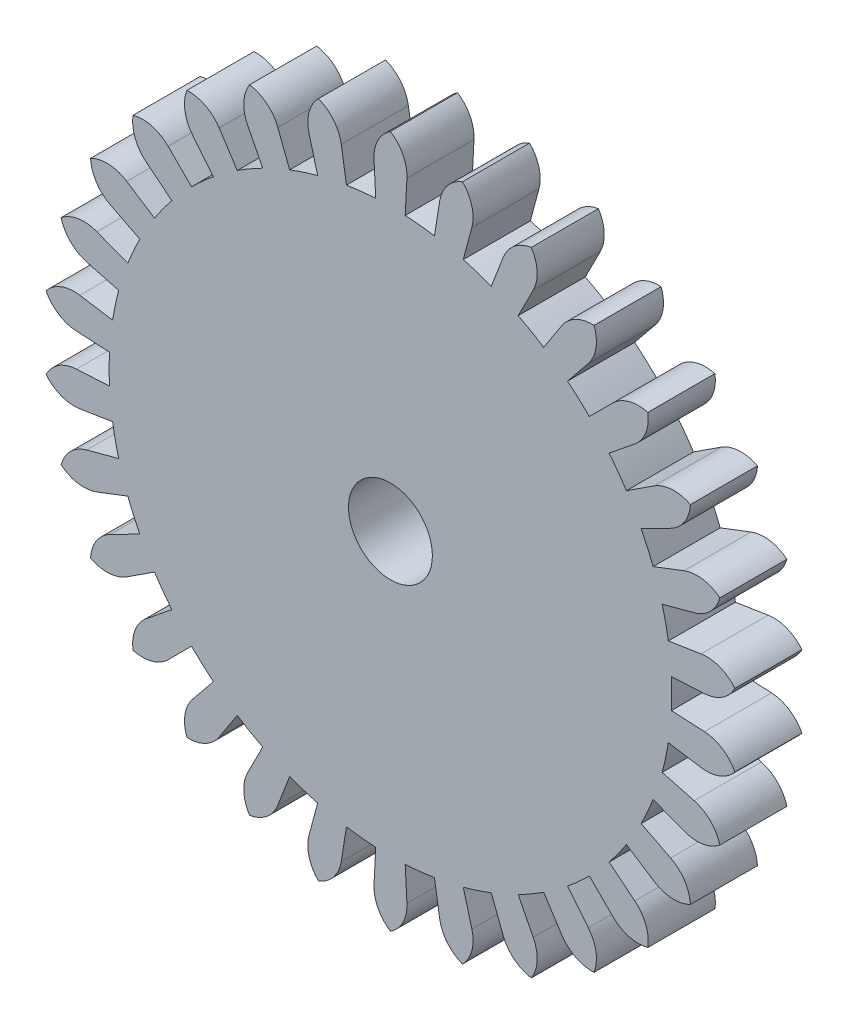
from build123d import *

# Parameters (mm, degrees)
SKETCH1_R           = 0.5
BOSS_EXTRUDE1_DEPTH = 0.8


with BuildPart() as part:
    # Sketch1 → Boss-Extrude1 (new body)
    with BuildSketch(Plane.XY):
        with BuildLine():
            Line((-0.175607589, 3.350401017), (-0.1962827, 3.744859557))
            ThreePointArc((-0.1962827, 3.744859557), (-0.149750341, 3.963731748), (0, 4.13))
            ThreePointArc((0, 4.13), (0.149750341, 3.963731748), (0.1962827, 3.744859557))
            Line((0.1962827, 3.744859557), (0.175607589, 3.350401017))
            ThreePointArc((0.175607589, 3.350401017), (0.350692994, 3.336620959), (0.524817399, 3.313697587))
            Line((0.524817399, 3.313697587), (0.58660663, 3.703834859))
            ThreePointArc((0.58660663, 3.703834859), (0.677628232, 3.908249546), (0.858675283, 4.039749591))
            ThreePointArc((0.858675283, 4.039749591), (0.970584107, 3.845979853), (0.970593535, 3.622215923))
            Line((0.970593535, 3.622215923), (0.868357682, 3.240675846))
            ThreePointArc((0.868357682, 3.240675846), (1.036752016, 3.190794612), (1.202305347, 3.132169672))
            Line((1.202305347, 3.132169672), (1.343858436, 3.500934804))
            ThreePointArc((1.343858436, 3.500934804), (1.475391201, 3.681958085), (1.679822336, 3.77294274))
            ThreePointArc((1.679822336, 3.77294274), (1.748998689, 3.560140183), (1.702484774, 3.341264071))
            Line((1.702484774, 3.341264071), (1.523156378, 2.989317589))
            ThreePointArc((1.523156378, 2.989317589), (1.6775, 2.90551523), (1.827246783, 2.813750912))
            Line((1.827246783, 2.813750912), (2.042377179, 3.1450271))
            ThreePointArc((2.042377179, 3.1450271), (2.208672494, 3.294747388), (2.427553092, 3.341240187))
            ThreePointArc((2.427553092, 3.341240187), (2.450973637, 3.118705303), (2.35996926, 2.914282947))
            Line((2.35996926, 2.914282947), (2.111385831, 2.60731181))
            ThreePointArc((2.111385831, 2.60731181), (2.244933184, 2.493250889), (2.372328767, 2.372357735))
            Line((2.372328767, 2.372357735), (2.65163424, 2.651666619))
            ThreePointArc((2.65163424, 2.651666619), (2.845424201, 2.763540419), (3.069188129, 2.763509404))
            ThreePointArc((3.069188129, 2.763509404), (3.045829275, 2.540968037), (2.914311764, 2.359933673))
            Line((2.914311764, 2.359933673), (2.607337592, 2.111353993))
            ThreePointArc((2.607337592, 2.111353993), (2.714252016, 1.972019521), (2.813728599, 1.827281142))
            Line((2.813728599, 1.827281142), (3.14500216, 2.042415583))
            ThreePointArc((3.14500216, 2.042415583), (3.357817217, 2.111553474), (3.576684918, 2.065))
            ThreePointArc((3.576684918, 2.065), (3.507567558, 1.852178274), (3.34128486, 1.702443974))
            Line((3.34128486, 1.702443974), (2.989336188, 1.523119875))
            ThreePointArc((2.989336188, 1.523119875), (3.06494501, 1.364601438), (3.13215499, 1.202343594))
            Line((3.13215499, 1.202343594), (3.500918394, 1.343901186))
            ThreePointArc((3.500918394, 1.343901186), (3.723457507, 1.367281509), (3.927863412, 1.276240187))
            ThreePointArc((3.927863412, 1.276240187), (3.816008308, 1.082439433), (3.622227774, 0.970549304))
            Line((3.622227774, 0.970549304), (3.240686449, 0.86831811))
            ThreePointArc((3.240686449, 0.86831811), (3.2816852, 0.697543723), (3.313691178, 0.524857862))
            Line((3.313691178, 0.524857862), (3.703827696, 0.586651858))
            ThreePointArc((3.703827696, 0.586651858), (3.926364838, 0.563252782), (4.107375428, 0.431702553))
            ThreePointArc((4.107375428, 0.431702553), (3.957671184, 0.265392795), (3.744861954, 0.196236972))
            Line((3.744861954, 0.196236972), (3.350403161, 0.175566677))
            ThreePointArc((3.350403161, 0.175566677), (3.355, 0), (3.350403161, -0.175566677))
            Line((3.350403161, -0.175566677), (3.744861954, -0.196236972))
            ThreePointArc((3.744861954, -0.196236972), (3.957671184, -0.265392795), (4.107375428, -0.431702553))
            ThreePointArc((4.107375428, -0.431702553), (3.926364838, -0.563252782), (3.703827696, -0.586651858))
            Line((3.703827696, -0.586651858), (3.313691178, -0.524857862))
            ThreePointArc((3.313691178, -0.524857862), (3.2816852, -0.697543723), (3.240686449, -0.86831811))
            Line((3.240686449, -0.86831811), (3.622227774, -0.970549304))
            ThreePointArc((3.622227774, -0.970549304), (3.816008308, -1.082439433), (3.927863412, -1.276240187))
            ThreePointArc((3.927863412, -1.276240187), (3.723457507, -1.367281509), (3.500918394, -1.343901186))
            Line((3.500918394, -1.343901186), (3.13215499, -1.202343594))
            ThreePointArc((3.13215499, -1.202343594), (3.06494501, -1.364601438), (2.989336188, -1.523119875))
            Line((2.989336188, -1.523119875), (3.34128486, -1.702443974))
            ThreePointArc((3.34128486, -1.702443974), (3.507567558, -1.852178274), (3.576684918, -2.065))
            ThreePointArc((3.576684918, -2.065), (3.357817217, -2.111553474), (3.14500216, -2.042415583))
            Line((3.14500216, -2.042415583), (2.813728599, -1.827281142))
            ThreePointArc((2.813728599, -1.827281142), (2.714252016, -1.972019521), (2.607337592, -2.111353993))
            Line((2.607337592, -2.111353993), (2.914311764, -2.359933673))
            ThreePointArc((2.914311764, -2.359933673), (3.045829275, -2.540968037), (3.069188129, -2.763509404))
            ThreePointArc((3.069188129, -2.763509404), (2.845424201, -2.763540419), (2.65163424, -2.651666619))
            Line((2.65163424, -2.651666619), (2.372328767, -2.372357735))
            ThreePointArc((2.372328767, -2.372357735), (2.244933184, -2.493250889), (2.111385831, -2.60731181))
            Line((2.111385831, -2.60731181), (2.35996926, -2.914282947))
            ThreePointArc((2.35996926, -2.914282947), (2.450973637, -3.118705303), (2.427553092, -3.341240187))
            ThreePointArc((2.427553092, -3.341240187), (2.208672494, -3.294747388), (2.042377179, -3.1450271))
            Line((2.042377179, -3.1450271), (1.827246783, -2.813750912))
            ThreePointArc((1.827246783, -2.813750912), (1.6775, -2.90551523), (1.523156378, -2.989317589))
            Line((1.523156378, -2.989317589), (1.702484774, -3.341264071))
            ThreePointArc((1.702484774, -3.341264071), (1.748998689, -3.560140183), (1.679822336, -3.77294274))
            ThreePointArc((1.679822336, -3.77294274), (1.475391201, -3.681958085), (1.343858436, -3.500934804))
            Line((1.343858436, -3.500934804), (1.202305347, -3.132169672))
            ThreePointArc((1.202305347, -3.132169672), (1.036752016, -3.190794612), (0.868357682, -3.240675846))
            Line((0.868357682, -3.240675846), (0.970593535, -3.622215923))
            ThreePointArc((0.970593535, -3.622215923), (0.970584107, -3.845979853), (0.858675283, -4.039749591))
            ThreePointArc((0.858675283, -4.039749591), (0.677628232, -3.908249546), (0.58660663, -3.703834859))
            Line((0.58660663, -3.703834859), (0.524817399, -3.313697587))
            ThreePointArc((0.524817399, -3.313697587), (0.350692994, -3.336620959), (0.175607589, -3.350401017))
            Line((0.175607589, -3.350401017), (0.1962827, -3.744859557))
            ThreePointArc((0.1962827, -3.744859557), (0.149750341, -3.963731748), (0, -4.13))
            ThreePointArc((0, -4.13), (-0.149750341, -3.963731748), (-0.1962827, -3.744859557))
            Line((-0.1962827, -3.744859557), (-0.175607589, -3.350401017))
            ThreePointArc((-0.175607589, -3.350401017), (-0.350692994, -3.336620959), (-0.524817399, -3.313697587))
            Line((-0.524817399, -3.313697587), (-0.58660663, -3.703834859))
            ThreePointArc((-0.58660663, -3.703834859), (-0.677628232, -3.908249546), (-0.858675283, -4.039749591))
            ThreePointArc((-0.858675283, -4.039749591), (-0.970584107, -3.845979853), (-0.970593535, -3.622215923))
            Line((-0.970593535, -3.622215923), (-0.868357682, -3.240675846))
            ThreePointArc((-0.868357682, -3.240675846), (-1.036752016, -3.190794612), (-1.202305347, -3.132169672))
            Line((-1.202305347, -3.132169672), (-1.343858436, -3.500934804))
            ThreePointArc((-1.343858436, -3.500934804), (-1.475391201, -3.681958085), (-1.679822336, -3.77294274))
            ThreePointArc((-1.679822336, -3.77294274), (-1.748998689, -3.560140183), (-1.702484774, -3.341264071))
            Line((-1.702484774, -3.341264071), (-1.523156378, -2.989317589))
            ThreePointArc((-1.523156378, -2.989317589), (-1.6775, -2.90551523), (-1.827246783, -2.813750912))
            Line((-1.827246783, -2.813750912), (-2.042377179, -3.1450271))
            ThreePointArc((-2.042377179, -3.1450271), (-2.208672494, -3.294747388), (-2.427553092, -3.341240187))
            ThreePointArc((-2.427553092, -3.341240187), (-2.450973637, -3.118705303), (-2.35996926, -2.914282947))
            Line((-2.35996926, -2.914282947), (-2.111385831, -2.60731181))
            ThreePointArc((-2.111385831, -2.60731181), (-2.244933184, -2.493250889), (-2.372328767, -2.372357735))
            Line((-2.372328767, -2.372357735), (-2.65163424, -2.651666619))
            ThreePointArc((-2.65163424, -2.651666619), (-2.845424201, -2.763540419), (-3.069188129, -2.763509404))
            ThreePointArc((-3.069188129, -2.763509404), (-3.045829275, -2.540968037), (-2.914311764, -2.359933673))
            Line((-2.914311764, -2.359933673), (-2.607337592, -2.111353993))
            ThreePointArc((-2.607337592, -2.111353993), (-2.714252016, -1.972019521), (-2.813728599, -1.827281142))
            Line((-2.813728599, -1.827281142), (-3.14500216, -2.042415583))
            ThreePointArc((-3.14500216, -2.042415583), (-3.357817217, -2.111553474), (-3.576684918, -2.065))
            ThreePointArc((-3.576684918, -2.065), (-3.507567558, -1.852178274), (-3.34128486, -1.702443974))
            Line((-3.34128486, -1.702443974), (-2.989336188, -1.523119875))
            ThreePointArc((-2.989336188, -1.523119875), (-3.06494501, -1.364601438), (-3.13215499, -1.202343594))
            Line((-3.13215499, -1.202343594), (-3.500918394, -1.343901186))
            ThreePointArc((-3.500918394, -1.343901186), (-3.723457507, -1.367281509), (-3.927863412, -1.276240187))
            ThreePointArc((-3.927863412, -1.276240187), (-3.816008308, -1.082439433), (-3.622227774, -0.970549304))
            Line((-3.622227774, -0.970549304), (-3.240686449, -0.86831811))
            ThreePointArc((-3.240686449, -0.86831811), (-3.2816852, -0.697543723), (-3.313691178, -0.524857862))
            Line((-3.313691178, -0.524857862), (-3.703827696, -0.586651858))
            ThreePointArc((-3.703827696, -0.586651858), (-3.926364838, -0.563252782), (-4.107375428, -0.431702553))
            ThreePointArc((-4.107375428, -0.431702553), (-3.957671184, -0.265392795), (-3.744861954, -0.196236972))
            Line((-3.744861954, -0.196236972), (-3.350403161, -0.175566677))
            ThreePointArc((-3.350403161, -0.175566677), (-3.355, 0), (-3.350403161, 0.175566677))
            Line((-3.350403161, 0.175566677), (-3.744861954, 0.196236972))
            ThreePointArc((-3.744861954, 0.196236972), (-3.957671184, 0.265392795), (-4.107375428, 0.431702553))
            ThreePointArc((-4.107375428, 0.431702553), (-3.926364838, 0.563252782), (-3.703827696, 0.586651858))
            Line((-3.703827696, 0.586651858), (-3.313691178, 0.524857862))
            ThreePointArc((-3.313691178, 0.524857862), (-3.2816852, 0.697543723), (-3.240686449, 0.86831811))
            Line((-3.240686449, 0.86831811), (-3.622227774, 0.970549304))
            ThreePointArc((-3.622227774, 0.970549304), (-3.816008308, 1.082439433), (-3.927863412, 1.276240187))
            ThreePointArc((-3.927863412, 1.276240187), (-3.723457507, 1.367281509), (-3.500918394, 1.343901186))
            Line((-3.500918394, 1.343901186), (-3.13215499, 1.202343594))
            ThreePointArc((-3.13215499, 1.202343594), (-3.06494501, 1.364601438), (-2.989336188, 1.523119875))
            Line((-2.989336188, 1.523119875), (-3.34128486, 1.702443974))
            ThreePointArc((-3.34128486, 1.702443974), (-3.507567558, 1.852178274), (-3.576684918, 2.065))
            ThreePointArc((-3.576684918, 2.065), (-3.357817217, 2.111553474), (-3.14500216, 2.042415583))
            Line((-3.14500216, 2.042415583), (-2.813728599, 1.827281142))
            ThreePointArc((-2.813728599, 1.827281142), (-2.714252016, 1.972019521), (-2.607337592, 2.111353993))
            Line((-2.607337592, 2.111353993), (-2.914311764, 2.359933673))
            ThreePointArc((-2.914311764, 2.359933673), (-3.045829275, 2.540968037), (-3.069188129, 2.763509404))
            ThreePointArc((-3.069188129, 2.763509404), (-2.845424201, 2.763540419), (-2.65163424, 2.651666619))
            Line((-2.65163424, 2.651666619), (-2.372328767, 2.372357735))
            ThreePointArc((-2.372328767, 2.372357735), (-2.244933184, 2.493250889), (-2.111385831, 2.60731181))
            Line((-2.111385831, 2.60731181), (-2.35996926, 2.914282947))
            ThreePointArc((-2.35996926, 2.914282947), (-2.450973637, 3.118705303), (-2.427553092, 3.341240187))
            ThreePointArc((-2.427553092, 3.341240187), (-2.208672494, 3.294747388), (-2.042377179, 3.1450271))
            Line((-2.042377179, 3.1450271), (-1.827246783, 2.813750912))
            ThreePointArc((-1.827246783, 2.813750912), (-1.6775, 2.90551523), (-1.523156378, 2.989317589))
            Line((-1.523156378, 2.989317589), (-1.702484774, 3.341264071))
            ThreePointArc((-1.702484774, 3.341264071), (-1.748998689, 3.560140183), (-1.679822336, 3.77294274))
            ThreePointArc((-1.679822336, 3.77294274), (-1.475391201, 3.681958085), (-1.343858436, 3.500934804))
            Line((-1.343858436, 3.500934804), (-1.202305347, 3.132169672))
            ThreePointArc((-1.202305347, 3.132169672), (-1.036752016, 3.190794612), (-0.868357682, 3.240675846))
            Line((-0.868357682, 3.240675846), (-0.970593535, 3.622215923))
            ThreePointArc((-0.970593535, 3.622215923), (-0.970584107, 3.845979853), (-0.858675283, 4.039749591))
            ThreePointArc((-0.858675283, 4.039749591), (-0.677628232, 3.908249546), (-0.58660663, 3.703834859))
            Line((-0.58660663, 3.703834859), (-0.524817399, 3.313697587))
            ThreePointArc((-0.524817399, 3.313697587), (-0.350692994, 3.336620959), (-0.175607589, 3.350401017))
        make_face()
        Circle(SKETCH1_R, mode=Mode.SUBTRACT)
    extrude(amount=BOSS_EXTRUDE1_DEPTH)


solid = part.part
